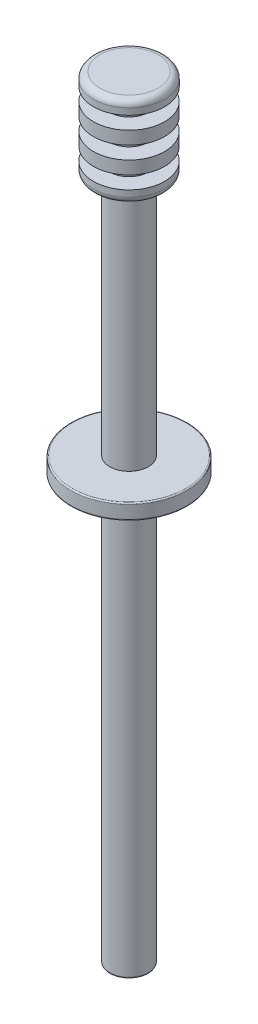
from build123d import *

# Parameters (mm, degrees)
SKETCH1_R            = 2.75
BOSS_EXTRUDE1_DEPTH  = 1
SKETCH2_R            = 1.5
BOSS_EXTRUDE2_DEPTH  = 1
BOSS_EXTRUDE3_START  = 1
SKETCH3_R            = 2.75
BOSS_EXTRUDE3_DEPTH  = 1
SKETCH4_R            = 1.5
BOSS_EXTRUDE4_DEPTH  = 1
BOSS_EXTRUDE5_START  = 1
SKETCH5_R            = 2.75
BOSS_EXTRUDE5_DEPTH  = 1
SKETCH6_R            = 1.5
BOSS_EXTRUDE6_DEPTH  = 1
BOSS_EXTRUDE7_START  = 1
SKETCH7_R            = 2.75
BOSS_EXTRUDE7_DEPTH  = 1
SKETCH8_R            = 1.5
BOSS_EXTRUDE8_DEPTH  = 18.75
SKETCH9_R            = 4.5
BOSS_EXTRUDE9_DEPTH  = 1.2
SKETCH10_R           = 1.5
BOSS_EXTRUDE10_DEPTH = 32.81
FILLET1_R            = 0.5
FILLET2_R            = 0.1
FILLET3_R            = 0.5
FILLET4_R            = 0.1


with BuildPart() as part:
    # Sketch1 → Boss-Extrude1 (new body)
    with BuildSketch(Plane(origin=(0, 0, 0), x_dir=(1, 0, 0), z_dir=(0, 1, 0))):
        with Locations(Location((0, 0, 0), (0, 0, 270))):
            Circle(SKETCH1_R)
    extrude(amount=BOSS_EXTRUDE1_DEPTH)

    # Sketch2 → Boss-Extrude2 (add)
    with BuildSketch(Plane.XZ):
        with Locations(Location((0, 0, 0), (0, 0, 270))):
            Circle(SKETCH2_R)
    extrude(amount=BOSS_EXTRUDE2_DEPTH)

    # Sketch3 → Boss-Extrude3 (add)
    with BuildSketch(Plane(origin=(0, -1, 0), x_dir=(-1, 0, 0), z_dir=(0, -1, 0)).offset(BOSS_EXTRUDE3_START)):
        with Locations(Location((0, 0, 0), (0, 0, 270))):
            Circle(SKETCH3_R)
    extrude(amount=-BOSS_EXTRUDE3_DEPTH)

    # Sketch4 → Boss-Extrude4 (add)
    with BuildSketch(Plane(origin=(0, -2, 0), x_dir=(-1, 0, 0), z_dir=(0, -1, 0))):
        with Locations(Location((0, 0, 0), (0, 0, 90))):
            Circle(SKETCH4_R)
    extrude(amount=BOSS_EXTRUDE4_DEPTH)

    # Sketch5 → Boss-Extrude5 (add)
    with BuildSketch(Plane(origin=(0, -3, 0), x_dir=(-1, 0, 0), z_dir=(0, -1, 0)).offset(BOSS_EXTRUDE5_START)):
        with Locations(Location((0, 0, 0), (0, 0, 270))):
            Circle(SKETCH5_R)
    extrude(amount=-BOSS_EXTRUDE5_DEPTH)

    # Sketch6 → Boss-Extrude6 (add)
    with BuildSketch(Plane.XZ.offset(4)):
        with Locations(Location((0, 0, 0), (0, 0, 270))):
            Circle(SKETCH6_R)
    extrude(amount=BOSS_EXTRUDE6_DEPTH)

    # Sketch7 → Boss-Extrude7 (add)
    with BuildSketch(Plane.XZ.offset(5).offset(BOSS_EXTRUDE7_START)):
        with Locations(Location((0, 0, 0), (0, 0, 90))):
            Circle(SKETCH7_R)
    extrude(amount=-BOSS_EXTRUDE7_DEPTH)

    # Sketch8 → Boss-Extrude8 (add)
    with BuildSketch(Plane(origin=(0, -6, 0), x_dir=(-1, 0, 0), z_dir=(0, -1, 0))):
        with Locations(Location((0, 0, 0), (0, 0, 90))):
            Circle(SKETCH8_R)
    extrude(amount=BOSS_EXTRUDE8_DEPTH)

    # Sketch9 → Boss-Extrude9 (add)
    with BuildSketch(Plane(origin=(0, -24.75, 0), x_dir=(-1, 0, 0), z_dir=(0, -1, 0))):
        with Locations(Location((0, 0, 0), (0, 0, 90))):
            Circle(SKETCH9_R)
    extrude(amount=BOSS_EXTRUDE9_DEPTH)

    # Sketch10 → Boss-Extrude10 (add)
    with BuildSketch(Plane.XZ.offset(25.95)):
        with Locations(Location((0, 0, 0), (0, 0, 270))):
            Circle(SKETCH10_R)
    extrude(amount=BOSS_EXTRUDE10_DEPTH)

    # Fillet1
    fillet1_edges = [part.edges().sort_by_distance(p)[0] for p in [
        (0, 1, -2.75),
    ]]
    fillet(fillet1_edges, radius=FILLET1_R)

    # Fillet2
    fillet2_edges = [part.edges().sort_by_distance(p)[0] for p in [
        (0, -24.75, 4.5),
        (0, -25.95, 4.5),
    ]]
    fillet(fillet2_edges, radius=FILLET2_R)

    # Fillet3
    fillet3_edges = [part.edges().sort_by_distance(p)[0] for p in [
        (0, -6, -2.75),
    ]]
    fillet(fillet3_edges, radius=FILLET3_R)

    # Fillet4
    fillet4_edges = [part.edges().sort_by_distance(p)[0] for p in [
        (0, -58.76, 1.5),
    ]]
    fillet(fillet4_edges, radius=FILLET4_R)


solid = part.part
